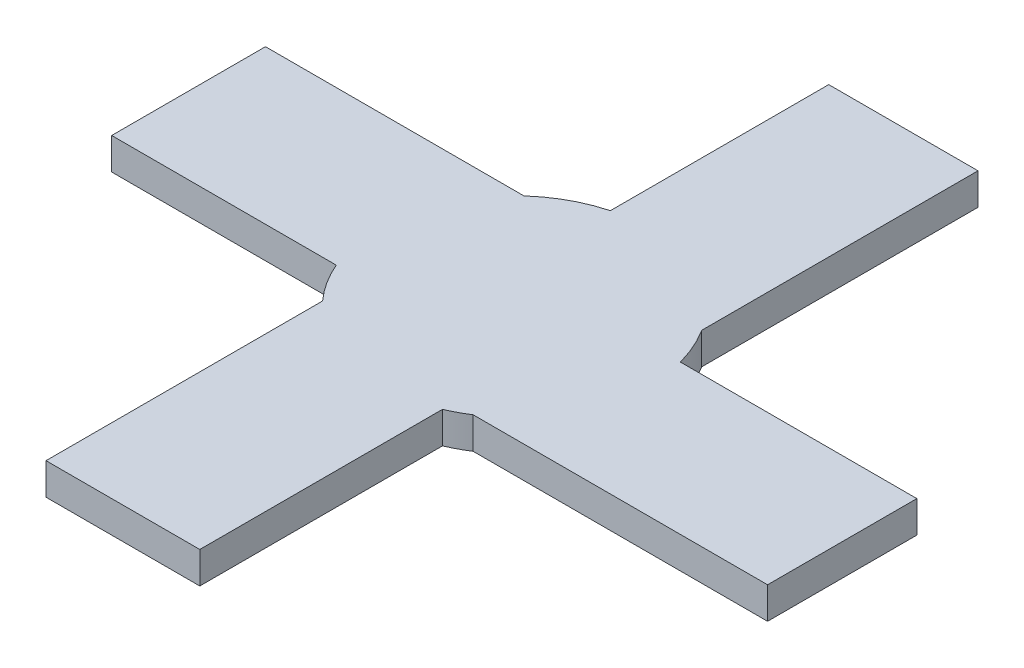
from build123d import *

# Parameters (mm, degrees)
BOSS_EXTRUDE1_DEPTH = 7
SKETCH2_R           = 30
BOSS_EXTRUDE2_DEPTH = 7


with BuildPart() as part:
    # Sketch1 → Boss-Extrude1 (new body)
    with BuildSketch(Plane(origin=(0, 0, 0), x_dir=(1, 0, 0), z_dir=(0, 1, 0))):
        Polygon((-77.26, -11.74), (-77.26, 22.26), (-7.74, 22.26), (-7.74, 77.26), (25.26, 77.26), (25.26, 7.74), (81.26, 7.74), (81.26, -25.26), (11.74, -25.26), (11.74, -81.26), (-22.26, -81.26), (-22.26, -11.74), align=None)
        with BuildLine():
            Line((-1.65, 1.3), (1.65, 1.3))
            ThreePointArc((1.65, 1.3), (2.188477631, 0), (1.65, -1.3))
            Line((1.65, -1.3), (-1.65, -1.3))
            ThreePointArc((-1.65, -1.3), (-2.188477631, 0), (-1.65, 1.3))
        make_face(mode=Mode.SUBTRACT)
    extrude(amount=BOSS_EXTRUDE1_DEPTH)

    # Sketch2 → Boss-Extrude2 (add)
    with BuildSketch(Plane(origin=(0, 0, 0), x_dir=(1, 0, 0), z_dir=(0, 1, 0))):
        Circle(SKETCH2_R)
    extrude(amount=BOSS_EXTRUDE2_DEPTH)


solid = part.part
